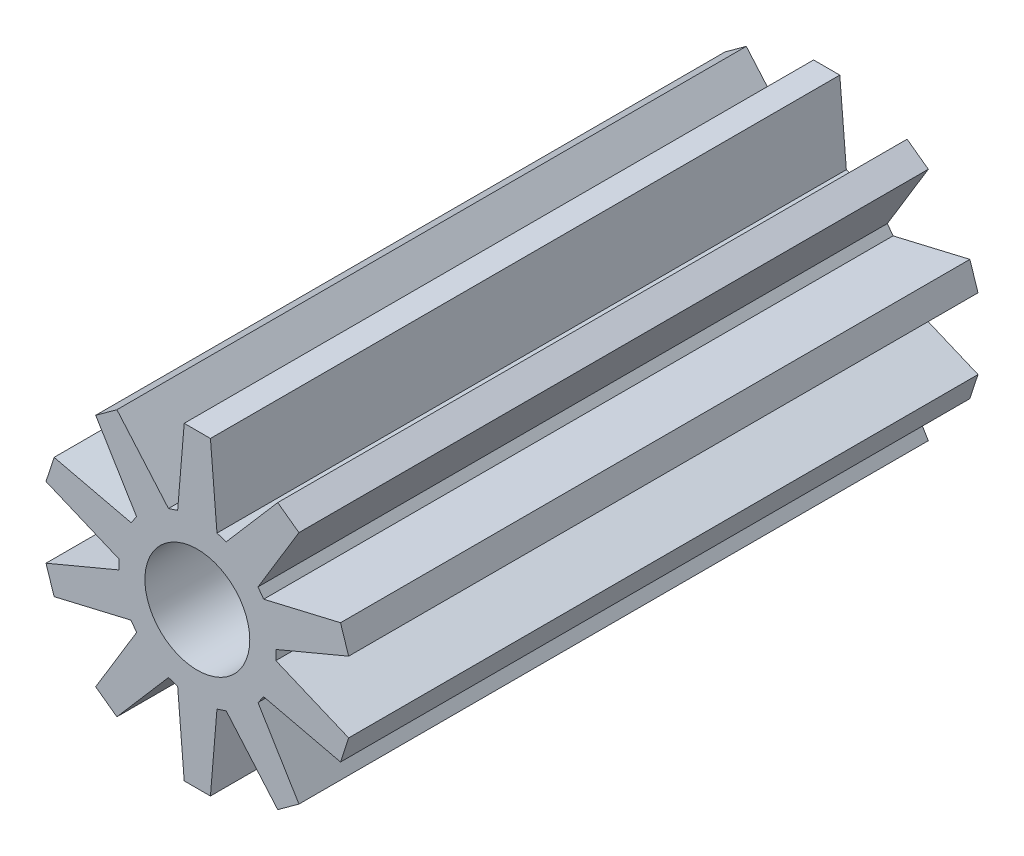
from build123d import *

# Parameters (mm, degrees)
SKETCH2_R           = 1
BOSS_EXTRUDE1_DEPTH = 12


with BuildPart() as part:
    # Sketch2 → Boss-Extrude1 (new body)
    with BuildSketch(Plane.XY):
        Polygon((-0.25, 2.952368755), (0.25, 2.952368755), (0.375, 1.452368755), (0.550299562, 1.395410474), (1.533104565, 2.535462809), (1.937613062, 2.241570183), (1.157062308, 0.954571535), (1.265403395, 0.805452821), (2.730615294, 1.150096248), (2.885123791, 0.67456799), (1.497166141, 0.092160434), (1.497166141, -0.092160434), (2.885123791, -0.67456799), (2.730615294, -1.150096248), (1.265403395, -0.805452821), (1.157062308, -0.954571535), (1.937613062, -2.241570183), (1.533104565, -2.535462809), (0.550299562, -1.395410474), (0.375, -1.452368755), (0.25, -2.952368755), (-0.25, -2.952368755), (-0.375, -1.452368755), (-0.550299562, -1.395410474), (-1.533104565, -2.535462809), (-1.937613062, -2.241570183), (-1.157062308, -0.954571535), (-1.265403395, -0.805452821), (-2.730615294, -1.150096248), (-2.885123791, -0.67456799), (-1.497166141, -0.092160434), (-1.497166141, 0.092160434), (-2.885123791, 0.67456799), (-2.730615294, 1.150096248), (-1.265403395, 0.805452821), (-1.157062308, 0.954571535), (-1.937613062, 2.241570183), (-1.533104565, 2.535462809), (-0.550299562, 1.395410474), (-0.375, 1.452368755), align=None)
        Circle(SKETCH2_R, mode=Mode.SUBTRACT)
    extrude(amount=BOSS_EXTRUDE1_DEPTH)


solid = part.part
